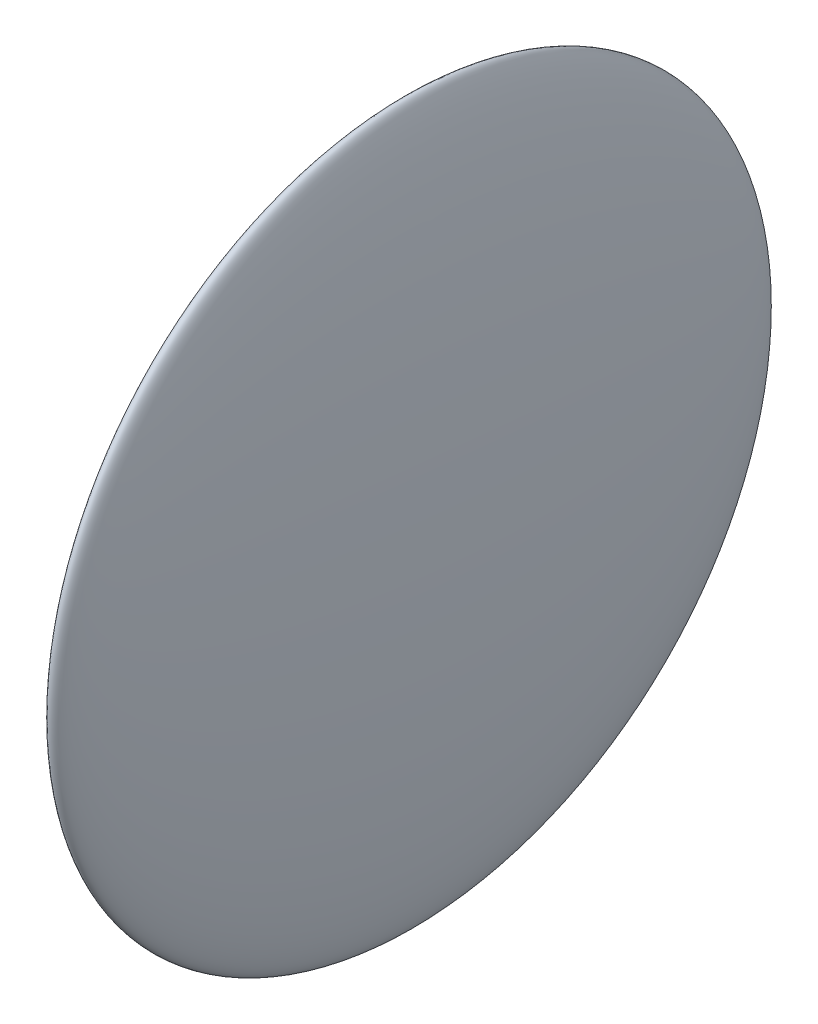
from build123d import *


with BuildPart() as part:
    # Çizim1 → Döndür5 (revolve)
    with BuildSketch(Plane.XY):
        with BuildLine():
            Line((-0.35, 3.75), (0.35, 3.75))
            add(Edge.make_bspline(
                [(0.35, 3.75), (0.35, 7.5), (0, 7.5), (-0.35, 7.5), (-0.35, 3.75)],
                knots=[1.570796327, 1.570796327, 1.570796327, 3.141592654, 3.141592654, 4.71238898, 4.71238898, 4.71238898], degree=2, weights=[1, 0.707106781, 1, 0.707106781, 1]))
        make_face()
    revolve(axis=Axis((-1.701966536, 3.75, 0), (1, 0, 0)))


solid = part.part
